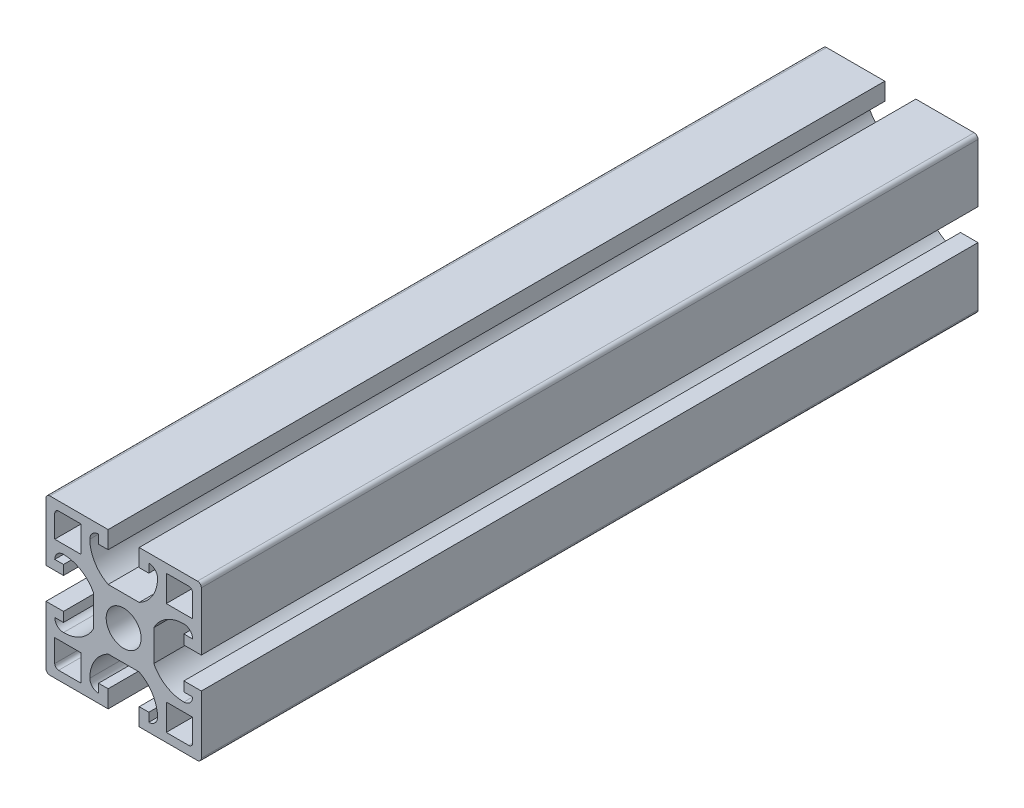
from build123d import *

# Parameters (mm, degrees)
SZKIC1_R                    = 4.5
DODANIE_WYCI_GNI_CIE1_DEPTH = 200


with BuildPart() as part:
    # Szkic1 → Dodanie-wyciągnięcie1 (new body)
    with BuildSketch(Plane.XY):
        with BuildLine():
            Line((4, 7.75478035), (-4, 7.75478035))
            ThreePointArc((-4, 7.75478035), (-7.445030717, 10.96569241), (-8.717134168, 15.500000044))
            ThreePointArc((-8.717134168, 15.500000044), (-8.058124425, 17.090990301), (-6.467134168, 17.750000044))
            Line((-6.467134168, 17.750000044), (-6.467134168, 15.500000044))
            Line((-6.467134168, 15.500000044), (-4, 15.500000044))
            Line((-4, 15.500000044), (-4, 20.000000044))
            Line((-4, 20.000000044), (-19, 20.000000044))
            ThreePointArc((-19, 20.000000044), (-19.707106812, 19.707106812), (-20.000000044, 19))
            Line((-20.000000044, 19), (-20.000000044, 4))
            Line((-20.000000044, 4), (-15.500000044, 4))
            Line((-15.500000044, 4), (-15.500000044, 6.471381771))
            Line((-15.500000044, 6.471381771), (-17.750000044, 6.471381771))
            ThreePointArc((-17.750000044, 6.471381771), (-17.090990301, 8.062372029), (-15.500000044, 8.721381771))
            ThreePointArc((-15.500000044, 8.721381771), (-10.962546302, 7.448087912), (-7.750000044, 4))
            Line((-7.750000044, 4), (-7.750000044, -4))
            ThreePointArc((-7.750000044, -4), (-10.962546302, -7.448087912), (-15.500000044, -8.721381771))
            ThreePointArc((-15.500000044, -8.721381771), (-17.090990301, -8.062372029), (-17.750000044, -6.471381771))
            Line((-17.750000044, -6.471381771), (-15.500000044, -6.471381771))
            Line((-15.500000044, -6.471381771), (-15.500000044, -4))
            Line((-15.500000044, -4), (-20.000000044, -4))
            Line((-20.000000044, -4), (-20.000000044, -19))
            ThreePointArc((-20.000000044, -19), (-19.707106812, -19.707106812), (-19, -20.000000044))
            Line((-19, -20.000000044), (-4, -20.000000044))
            Line((-4, -20.000000044), (-4, -15.500000044))
            Line((-4, -15.500000044), (-6.467134168, -15.500000044))
            Line((-6.467134168, -15.500000044), (-6.467134168, -17.750000044))
            ThreePointArc((-6.467134168, -17.750000044), (-8.058124425, -17.090990301), (-8.717134168, -15.500000044))
            ThreePointArc((-8.717134168, -15.500000044), (-7.445030717, -10.96569241), (-4, -7.75478035))
            Line((-4, -7.75478035), (4, -7.75478035))
            ThreePointArc((4, -7.75478035), (7.445030717, -10.96569241), (8.717134168, -15.500000044))
            ThreePointArc((8.717134168, -15.500000044), (8.058124425, -17.090990301), (6.467134168, -17.750000044))
            Line((6.467134168, -17.750000044), (6.467134168, -15.500000044))
            Line((6.467134168, -15.500000044), (4, -15.500000044))
            Line((4, -15.500000044), (4, -20.000000044))
            Line((4, -20.000000044), (19, -20.000000044))
            ThreePointArc((19, -20.000000044), (19.707106812, -19.707106812), (20.000000044, -19))
            Line((20.000000044, -19), (20.000000044, -4))
            Line((20.000000044, -4), (15.500000044, -4))
            Line((15.500000044, -4), (15.500000044, -6.471381771))
            Line((15.500000044, -6.471381771), (17.750000044, -6.471381771))
            ThreePointArc((17.750000044, -6.471381771), (17.090990301, -8.062372029), (15.500000044, -8.721381771))
            ThreePointArc((15.500000044, -8.721381771), (10.962546302, -7.448087912), (7.750000044, -4))
            Line((7.750000044, -4), (7.750000044, 4))
            ThreePointArc((7.750000044, 4), (10.962546302, 7.448087912), (15.500000044, 8.721381771))
            ThreePointArc((15.500000044, 8.721381771), (17.090990301, 8.062372029), (17.750000044, 6.471381771))
            Line((17.750000044, 6.471381771), (15.500000044, 6.471381771))
            Line((15.500000044, 6.471381771), (15.500000044, 4))
            Line((15.500000044, 4), (20.000000044, 4))
            Line((20.000000044, 4), (20.000000044, 19))
            ThreePointArc((20.000000044, 19), (19.707106812, 19.707106812), (19, 20.000000044))
            Line((19, 20.000000044), (4, 20.000000044))
            Line((4, 20.000000044), (4, 15.500000044))
            Line((4, 15.500000044), (6.467134168, 15.500000044))
            Line((6.467134168, 15.500000044), (6.467134168, 17.750000044))
            ThreePointArc((6.467134168, 17.750000044), (8.058124425, 17.090990301), (8.717134168, 15.500000044))
            ThreePointArc((8.717134168, 15.500000044), (7.445030717, 10.96569241), (4, 7.75478035))
        make_face()
        Circle(SZKIC1_R, mode=Mode.SUBTRACT)
        with BuildLine():
            Line((-17.750000044, 10.971381771), (-17.750000044, 16.754247647))
            ThreePointArc((-17.750000044, 16.754247647), (-17.457106825, 17.461354428), (-16.750000044, 17.754247647))
            Line((-16.750000044, 17.754247647), (-10.967134168, 17.754247647))
            Line((-10.967134168, 17.754247647), (-10.967134168, 10.971381771))
            Line((-10.967134168, 10.971381771), (-17.750000044, 10.971381771))
        make_face(mode=Mode.SUBTRACT)
        with BuildLine():
            Line((10.967134168, 10.971381771), (17.750000044, 10.971381771))
            Line((17.750000044, 10.971381771), (17.750000044, 16.754247647))
            ThreePointArc((17.750000044, 16.754247647), (17.457106825, 17.461354428), (16.750000044, 17.754247647))
            Line((16.750000044, 17.754247647), (10.967134168, 17.754247647))
            Line((10.967134168, 17.754247647), (10.967134168, 10.971381771))
        make_face(mode=Mode.SUBTRACT)
        with BuildLine():
            Line((17.750000044, -10.971381771), (17.750000044, -16.754247647))
            ThreePointArc((17.750000044, -16.754247647), (17.457106825, -17.461354428), (16.750000044, -17.754247647))
            Line((16.750000044, -17.754247647), (10.967134168, -17.754247647))
            Line((10.967134168, -17.754247647), (10.967134168, -10.971381771))
            Line((10.967134168, -10.971381771), (17.750000044, -10.971381771))
        make_face(mode=Mode.SUBTRACT)
        with BuildLine():
            Line((-10.967134168, -10.971381771), (-17.750000044, -10.971381771))
            Line((-17.750000044, -10.971381771), (-17.750000044, -16.754247647))
            ThreePointArc((-17.750000044, -16.754247647), (-17.457106825, -17.461354428), (-16.750000044, -17.754247647))
            Line((-16.750000044, -17.754247647), (-10.967134168, -17.754247647))
            Line((-10.967134168, -17.754247647), (-10.967134168, -10.971381771))
        make_face(mode=Mode.SUBTRACT)
    extrude(amount=DODANIE_WYCI_GNI_CIE1_DEPTH)


solid = part.part
